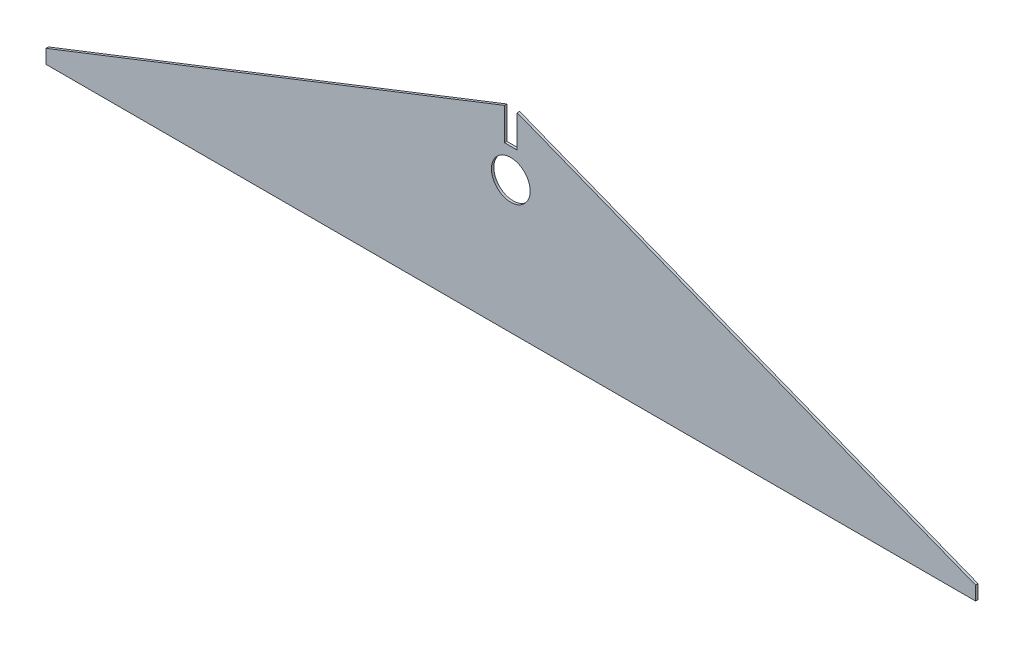
from build123d import *

# Parameters (mm, degrees)
SKETCH1_R           = 152.4
BOSS_EXTRUDE1_DEPTH = 19.05


with BuildPart() as part:
    # Sketch1 → Boss-Extrude1 (new body)
    with BuildSketch(Plane.XY):
        Polygon((0, 0), (3657.6, 0), (3657.6, 109.22), (50.8, 1524), (50.8, 1270), (-50.8, 1270), (-50.8, 1524), (-3657.6, 109.22), (-3657.6, 0), align=None)
        with Locations(Location((0, 1041.4, 0), (0, 0, 180))):
            Circle(SKETCH1_R, mode=Mode.SUBTRACT)
    extrude(amount=BOSS_EXTRUDE1_DEPTH)


solid = part.part
